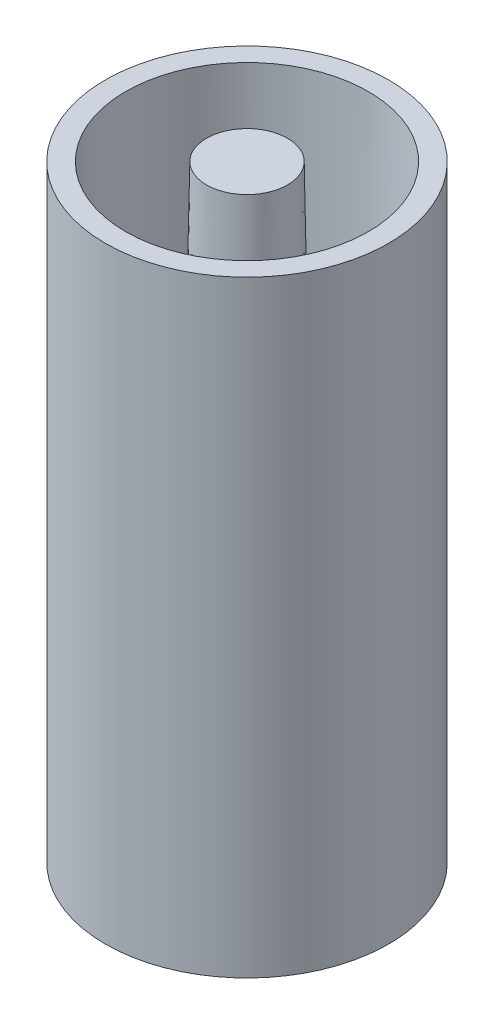
from build123d import *

# Parameters (mm, degrees)
SKETCH1_R           = 22.225
BOSS_EXTRUDE1_DEPTH = 95.25
SKETCH6_R           = 19.05
SKETCH6_R_2         = 6.35
CUT_EXTRUDE1_DEPTH  = 88.9
CUT_EXTRUDE1_DRAFT  = -1


with BuildPart() as part:
    # Sketch1 → Boss-Extrude1 (new body)
    with BuildSketch(Plane(origin=(0, 0, 0), x_dir=(1, 0, 0), z_dir=(0, 1, 0))):
        with Locations(Location((0, 0, 0), (0, 0, 270))):
            Circle(SKETCH1_R)
    extrude(amount=BOSS_EXTRUDE1_DEPTH)


with BuildPart() as cut_extrude1_tool:
    # Sketch6 → Cut-Extrude1 (with draft: the straight prism first)
    with BuildSketch(Plane(origin=(0, 95.25, 0), x_dir=(1, 0, 0), z_dir=(0, 1, 0))):
        Circle(SKETCH6_R)
        Circle(SKETCH6_R_2, mode=Mode.SUBTRACT)
    extrude(amount=-CUT_EXTRUDE1_DEPTH)
    # Cut-Extrude1: the draft: its side faces are tilted about the plane it starts from
    cut_extrude1_sides = [cut_extrude1_tool.faces().sort_by_distance(p)[0] for p in [
        (-19.05, 50.8, 0),
        (-6.35, 50.8, 0),
    ]]
    draft(cut_extrude1_sides, Plane(origin=(0, 95.25, 0), x_dir=(1, 0, 0), z_dir=(0, 1, 0)), CUT_EXTRUDE1_DRAFT)


with BuildPart() as part_1:
    add(part.part)

    # Cut-Extrude1: cut by cut_extrude1_tool
    add(cut_extrude1_tool.part, mode=Mode.SUBTRACT)


solid = part_1.part
